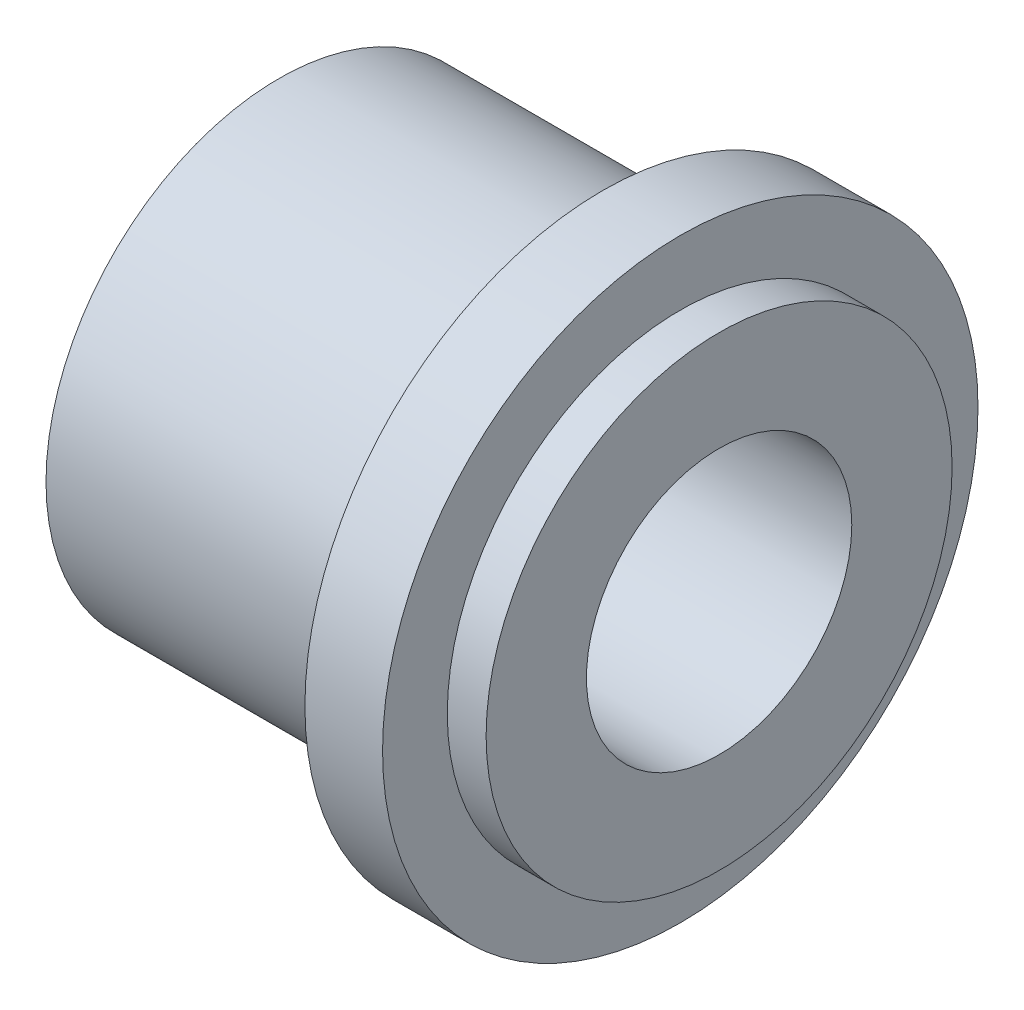
from build123d import *

# Parameters (mm, degrees)
SKETCH_1_R           = 23
EXTRUDE_1_DEPTH      = 6
EXTRUDE_2_DEPTH      = 25
EXTRUDE_2_DEPTH_BACK = 9
SKETCH_2_R           = 18
SKETCH_3_R           = 10.25
CUT_EXTRUDE_1_DEPTH  = 48.053161424


with BuildPart() as part:
    # 草图1 → 凸台-拉伸1 (new body)
    with BuildSketch(Plane(origin=(0, 0, 0), x_dir=(0, 0, -1), z_dir=(1, 0, 0))):
        Circle(SKETCH_1_R)
    extrude(amount=EXTRUDE_1_DEPTH)

    # 草图2 → 凸台-拉伸2 (add, two sides: drawn at the far end of the back side and taken through both)
    with BuildSketch(Plane.ZY.offset(-EXTRUDE_2_DEPTH_BACK)):
        Circle(SKETCH_2_R)
    extrude(amount=EXTRUDE_2_DEPTH + EXTRUDE_2_DEPTH_BACK)

    # 草图3 → 切除-拉伸1 (cut, through all)
    with BuildSketch(Plane(origin=(9, 0, 0), x_dir=(0, 0, -1), z_dir=(1, 0, 0))):
        Circle(SKETCH_3_R)
    extrude(amount=-CUT_EXTRUDE_1_DEPTH, mode=Mode.SUBTRACT)


solid = part.part
